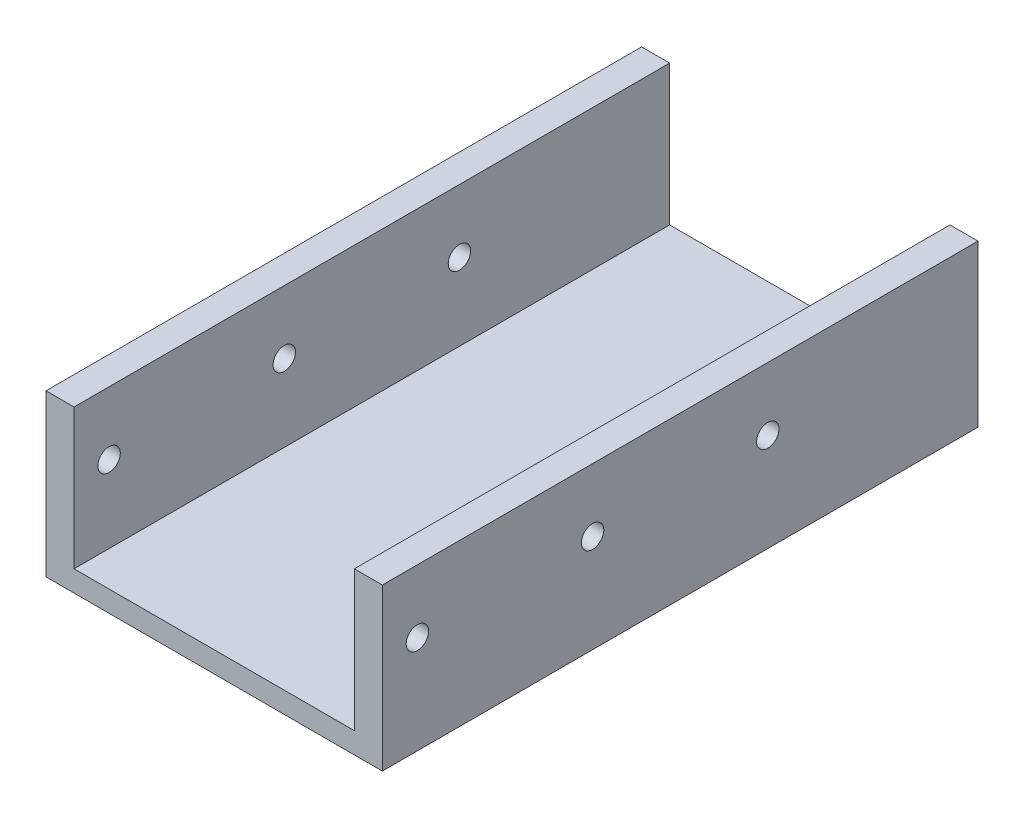
from build123d import *

# Parameters (mm, degrees)
SKETCH_2_W          = 48
SKETCH_2_H          = 110
EXTRUDE_1_DEPTH     = 3
SKETCH_3_W          = 4
SKETCH_3_H          = 110
EXTRUDE_2_DEPTH     = 20
SKETCH_4_R          = 1.6
CUT_EXTRUDE_1_DEPTH = 77.537572473
SKETCH_5_W          = 25
SKETCH_5_H          = 23
CUT_EXTRUDE_2_DEPTH = 77.537572473


with BuildPart() as part:
    # 草图2 → 凸台-拉伸1 (new body)
    with BuildSketch(Plane(origin=(0, 0, 0), x_dir=(1, 0, 0), z_dir=(0, 1, 0))):
        Rectangle(SKETCH_2_W, SKETCH_2_H)
    extrude(amount=EXTRUDE_1_DEPTH)

    # 草图3 → 凸台-拉伸2 (add)
    with BuildSketch(Plane(origin=(0, 3, 0), x_dir=(1, 0, 0), z_dir=(0, 1, 0))):
        with Locations((-22, 0)):
            Rectangle(SKETCH_3_W, SKETCH_3_H)
        with Locations((22, 0)):
            Rectangle(SKETCH_3_W, SKETCH_3_H)
    extrude(amount=EXTRUDE_2_DEPTH)

    # 草图4 → 切除-拉伸1 (cut, through all)
    with BuildSketch(Plane.ZY.offset(24)):
        with Locations((0, 14)):
            Circle(SKETCH_4_R)
        with Locations((-25, 14)):
            Circle(SKETCH_4_R)
        with Locations(Location((25, 14, 0), (0, 0, 180))):
            Circle(SKETCH_4_R)
    extrude(amount=-CUT_EXTRUDE_1_DEPTH, mode=Mode.SUBTRACT)

    # 草图5 → 切除-拉伸2 (cut, through all)
    with BuildSketch(Plane(origin=(24, 0, 0), x_dir=(0, 0, -1), z_dir=(1, 0, 0))):
        with Locations((-42.5, 11.5)):
            Rectangle(SKETCH_5_W, SKETCH_5_H)
    extrude(amount=-CUT_EXTRUDE_2_DEPTH, mode=Mode.SUBTRACT)


solid = part.part
